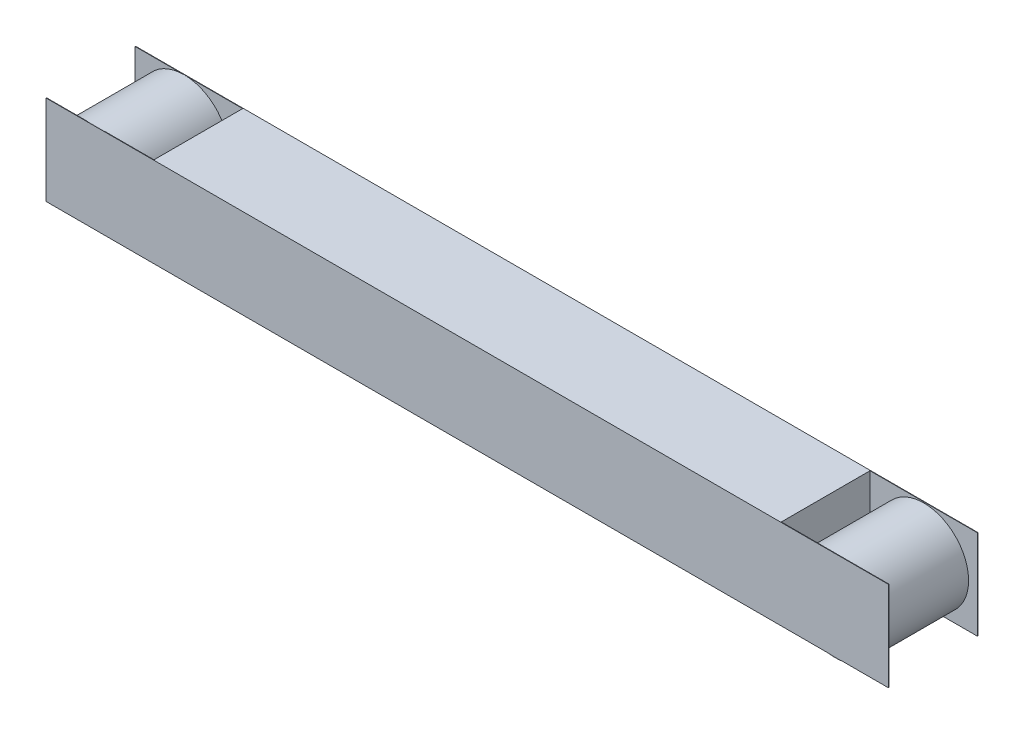
from build123d import *

# Parameters (mm, degrees)
SKETCH1_W           = 47
SKETCH1_H           = 5
BOSS_EXTRUDE1_DEPTH = 5
SKETCH3_W           = 6
SKETCH3_H           = 5.264109691
SKETCH3_H_2         = 5.408392742
CUT_EXTRUDE1_DEPTH  = 2.475
SKETCH4_R           = 2.5
BOSS_EXTRUDE2_DEPTH = 4.95
SKETCH5_R           = 2.5
BOSS_EXTRUDE3_DEPTH = 4.95


with BuildPart() as part:
    # Sketch1 → Boss-Extrude1 (new body)
    with BuildSketch(Plane.XY):
        with Locations((23.5, -2.5)):
            Rectangle(SKETCH1_W, SKETCH1_H)
    extrude(amount=BOSS_EXTRUDE1_DEPTH)

    # Sketch3 → Cut-Extrude1 (cut, symmetric)
    with BuildSketch(Plane.XY.offset(2.5)):
        with Locations((3, -2.632054846)):
            Rectangle(SKETCH3_W, SKETCH3_H)
        with Locations((44, -2.55991332)):
            Rectangle(SKETCH3_W, SKETCH3_H_2)
    extrude(amount=CUT_EXTRUDE1_DEPTH, both=True, mode=Mode.SUBTRACT)

    # Sketch4 → Boss-Extrude2 (add)
    with BuildSketch(Plane.XY.offset(0.025)):
        with Locations(Location((44, -2.555494601, 0), (0, 0, 257.905173383))):
            Circle(SKETCH4_R)
    extrude(amount=BOSS_EXTRUDE2_DEPTH)

    # Sketch5 → Boss-Extrude3 (add)
    with BuildSketch(Plane.XY.offset(0.025)):
        with Locations(Location((2.73169256, -2.5, 0), (0, 0, 90))):
            Circle(SKETCH5_R)
    extrude(amount=BOSS_EXTRUDE3_DEPTH)


solid = part.part
